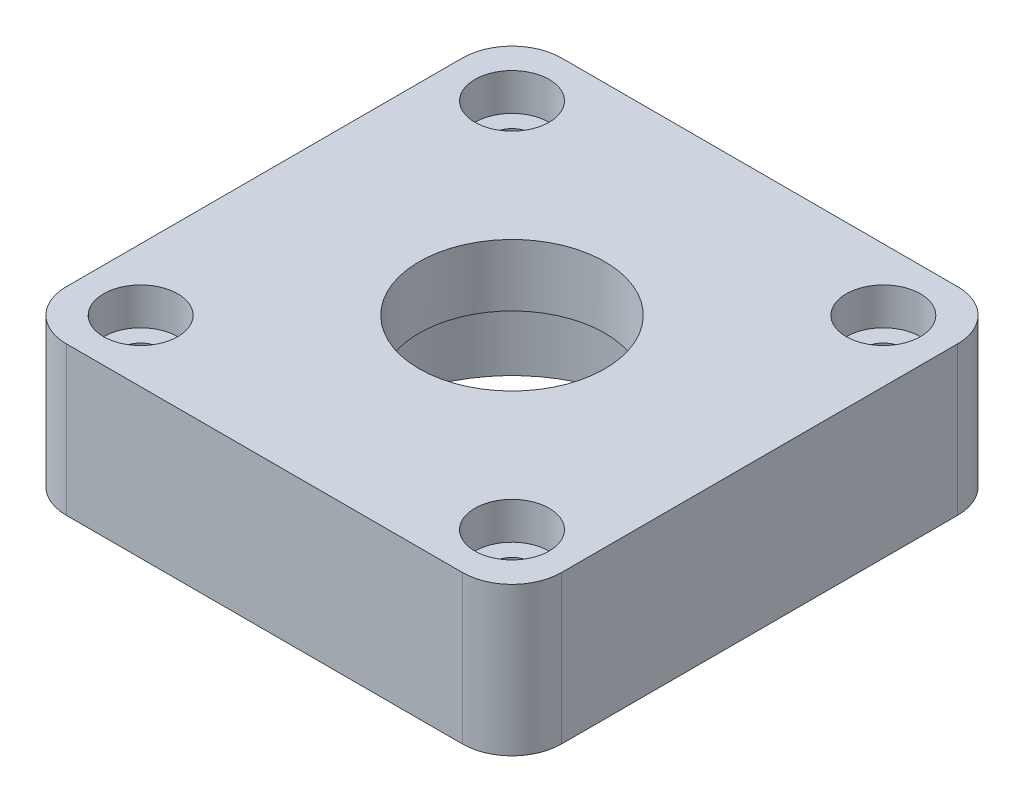
from build123d import *

# Parameters (mm, degrees)
SKETCH1_W           = 40
SKETCH1_H           = 40
BOSS_EXTRUDE1_DEPTH = 12
SKETCH2_R           = 11
CUT_EXTRUDE1_DEPTH  = 7
SKETCH3_R           = 7.5
CUT_EXTRUDE2_DEPTH  = 31.724582991
FILLET1_R           = 4
SKETCH4_R           = 1.5
CUT_EXTRUDE3_DEPTH  = 31.724582991
SKETCH5_R           = 3
CUT_EXTRUDE4_DEPTH  = 3


with BuildPart() as part:
    # Sketch1 → Boss-Extrude1 (new body)
    with BuildSketch(Plane(origin=(0, 0, 0), x_dir=(1, 0, 0), z_dir=(0, 1, 0))):
        Rectangle(SKETCH1_W, SKETCH1_H)
    extrude(amount=BOSS_EXTRUDE1_DEPTH)

    # Sketch2 → Cut-Extrude1 (cut)
    with BuildSketch(Plane.XZ):
        with Locations(Location((0, 0, 0), (0, 0, 270))):
            Circle(SKETCH2_R)
    extrude(amount=-CUT_EXTRUDE1_DEPTH, mode=Mode.SUBTRACT)

    # Sketch3 → Cut-Extrude2 (cut, through all)
    with BuildSketch(Plane(origin=(0, 12, 0), x_dir=(1, 0, 0), z_dir=(0, 1, 0))):
        with Locations(Location((0, 0, 0), (0, 0, 270))):
            Circle(SKETCH3_R)
    extrude(amount=-CUT_EXTRUDE2_DEPTH, mode=Mode.SUBTRACT)

    # Fillet1
    fillet1_edges = [part.edges().sort_by_distance(p)[0] for p in [
        (20, 6, 20),
        (-20, 6, 20),
        (-20, 6, -20),
        (20, 6, -20),
    ]]
    fillet(fillet1_edges, radius=FILLET1_R)

    # Sketch4 → Cut-Extrude3 (cut, through all)
    with BuildSketch(Plane(origin=(0, 12, 0), x_dir=(1, 0, 0), z_dir=(0, 1, 0))):
        with Locations(Location((-15, 15, 0), (0, 0, 270))):
            Circle(SKETCH4_R)
        with Locations(Location((15, 15, 0), (0, 0, 90))):
            Circle(SKETCH4_R)
        with Locations(Location((15, -15, 0), (0, 0, 270))):
            Circle(SKETCH4_R)
        with Locations(Location((-15, -15, 0), (0, 0, 90))):
            Circle(SKETCH4_R)
    extrude(amount=-CUT_EXTRUDE3_DEPTH, mode=Mode.SUBTRACT)

    # Sketch5 → Cut-Extrude4 (cut)
    with BuildSketch(Plane(origin=(0, 12, 0), x_dir=(1, 0, 0), z_dir=(0, 1, 0))):
        with Locations(Location((-15, -15, 0), (0, 0, 270))):
            Circle(SKETCH5_R)
        with Locations(Location((-15, 15, 0), (0, 0, 90))):
            Circle(SKETCH5_R)
        with Locations(Location((15, -15, 0), (0, 0, 90))):
            Circle(SKETCH5_R)
        with Locations(Location((15, 15, 0), (0, 0, 270))):
            Circle(SKETCH5_R)
    extrude(amount=-CUT_EXTRUDE4_DEPTH, mode=Mode.SUBTRACT)


solid = part.part
